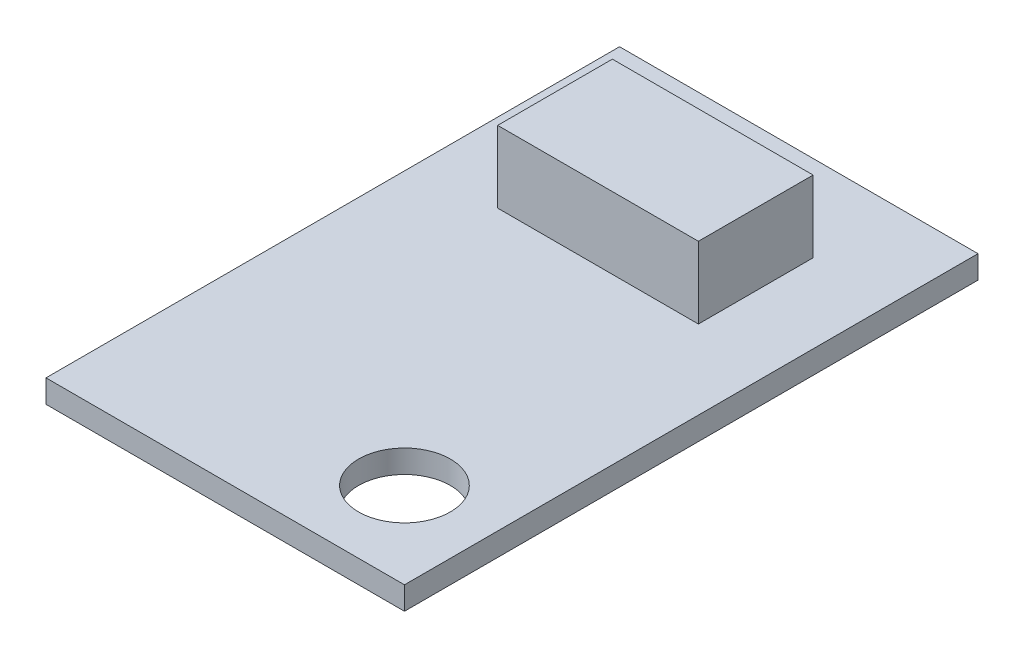
from build123d import *

# Parameters (mm, degrees)
SKETCH1_W           = 12.5
SKETCH1_H           = 20
SKETCH1_R           = 1.6
BOSS_EXTRUDE1_DEPTH = 0.8
SKETCH2_W           = 7
SKETCH2_H           = 4
BOSS_EXTRUDE2_DEPTH = 2.5


with BuildPart() as part:
    # Sketch1 → Boss-Extrude1 (new body)
    with BuildSketch(Plane(origin=(0, 0, 0), x_dir=(1, 0, 0), z_dir=(0, 1, 0))):
        with Locations((0, 10)):
            Rectangle(SKETCH1_W, SKETCH1_H)
        with Locations(Location((3.25, 3, 0), (0, 0, 270))):
            Circle(SKETCH1_R, mode=Mode.SUBTRACT)
    extrude(amount=BOSS_EXTRUDE1_DEPTH)

    # Sketch2 → Boss-Extrude2 (add)
    with BuildSketch(Plane(origin=(0, 0.8, 0), x_dir=(1, 0, 0), z_dir=(0, 1, 0))):
        with Locations((0, 15)):
            Rectangle(SKETCH2_W, SKETCH2_H)
    extrude(amount=BOSS_EXTRUDE2_DEPTH)


solid = part.part
